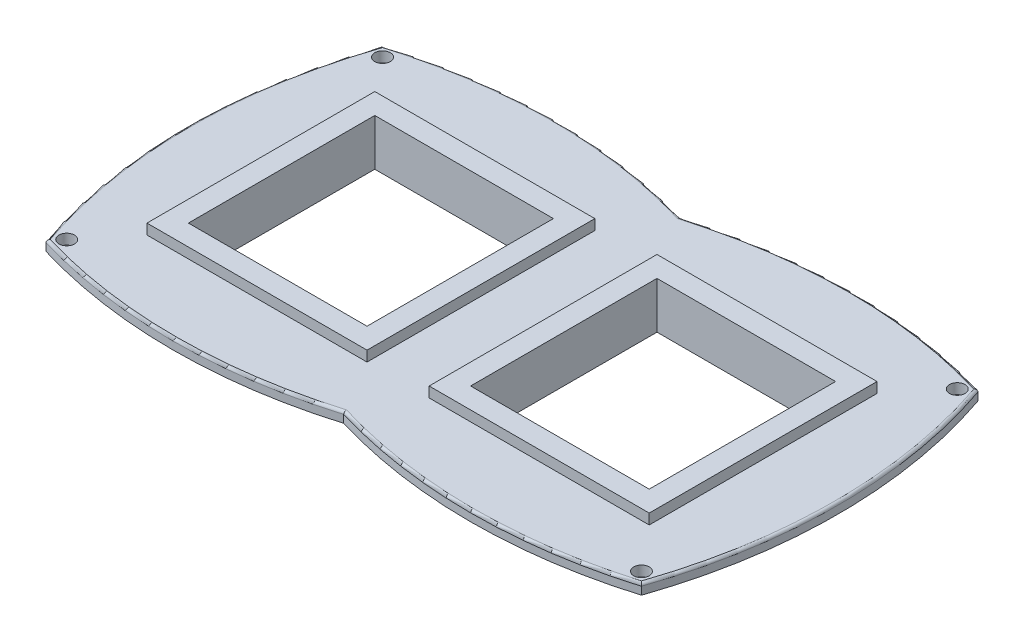
from build123d import *

# Parameters (mm, degrees)
BOSS_EXTRUDE1_DEPTH = 2
HOLE1_D             = 3
HOLE1_DEPTH         = 10
FILLET1_R           = 0.5
SKETCH7_W           = 34.5
SKETCH7_H           = 36
CUT_EXTRUDE1_DEPTH  = 2
SKETCH9_W           = 36.5
SKETCH9_H           = 38
SKETCH9_W_2         = 34.5
SKETCH9_H_2         = 36
BOSS_EXTRUDE2_DEPTH = 5
SKETCH10_W          = 42.5
SKETCH10_H          = 44
SKETCH10_W_2        = 34.5
SKETCH10_H_2        = 36
BOSS_EXTRUDE3_DEPTH = 2


with BuildPart() as part:
    # Sketch2 → Boss-Extrude1 (new body)
    with BuildSketch(Plane(origin=(0, 0, 0), x_dir=(1, 0, 0), z_dir=(0, 1, 0))):
        with BuildLine():
            ThreePointArc((-57.5, 32.5), (-28.75, 36.721936228), (0, 32.5))
            ThreePointArc((0, 32.5), (28.75, 36.721936228), (57.5, 32.5))
            ThreePointArc((57.5, 32.5), (62.928598403, 0), (57.5, -32.5))
            ThreePointArc((57.5, -32.5), (28.75, -36.721936228), (0, -32.5))
            ThreePointArc((0, -32.5), (-28.75, -36.721936228), (-57.5, -32.5))
            ThreePointArc((-57.5, -32.5), (-62.928598403, 0), (-57.5, 32.5))
        make_face()
    extrude(amount=BOSS_EXTRUDE1_DEPTH)

    # Hole1
    with Locations(Plane(origin=(0, 2, 0), x_dir=(1, 0, 0), z_dir=(0, 1, 0))):
        with Locations((-55.5, 30.5), (55.5, 30.5), (55.5, -30.5), (-55.5, -30.5)):
            Hole(HOLE1_D / 2, depth=HOLE1_DEPTH)

    # Fillet1
    fillet1_edges = [part.edges().sort_by_distance(p)[0] for p in [
        (28.75, 2, 36.721936228),
        (62.928598403, 2, 0),
        (28.75, 2, -36.721936228),
        (-28.75, 2, -36.721936228),
        (-62.928598403, 2, 0),
        (-28.75, 2, 36.721936228),
    ]]
    fillet(fillet1_edges, radius=FILLET1_R)

    # Sketch7 → Cut-Extrude1 (cut)
    with BuildSketch(Plane(origin=(0, 2, 0), x_dir=(1, 0, 0), z_dir=(0, 1, 0))):
        with Locations((-27.25, 0)):
            Rectangle(SKETCH7_W, SKETCH7_H)
    cut_extrude1 = extrude(amount=-CUT_EXTRUDE1_DEPTH, mode=Mode.SUBTRACT)

    # Sketch9 → Boss-Extrude2 (add)
    with BuildSketch(Plane.XZ):
        with Locations((-27.25, 0)):
            Rectangle(SKETCH9_W, SKETCH9_H)
        with Locations((-27.25, 0)):
            Rectangle(SKETCH9_W_2, SKETCH9_H_2, mode=Mode.SUBTRACT)
    boss_extrude2 = extrude(amount=BOSS_EXTRUDE2_DEPTH)

    # Sketch10 → Boss-Extrude3 (add)
    with BuildSketch(Plane(origin=(0, 2, 0), x_dir=(1, 0, 0), z_dir=(0, 1, 0))):
        with Locations((-27.25, 0)):
            Rectangle(SKETCH10_W, SKETCH10_H)
        with Locations((-27.25, 0)):
            Rectangle(SKETCH10_W_2, SKETCH10_H_2, mode=Mode.SUBTRACT)
    boss_extrude3 = extrude(amount=BOSS_EXTRUDE3_DEPTH)

    # Mirror1: Cut-Extrude1, Boss-Extrude2, Boss-Extrude3 across plane
    add(cut_extrude1.mirror(Plane(origin=(0, 0, 0), x_dir=(0, 0, 1), z_dir=(1, 0, 0))), mode=Mode.SUBTRACT)
    add(boss_extrude2.mirror(Plane(origin=(0, 0, 0), x_dir=(0, 0, 1), z_dir=(1, 0, 0))))
    add(boss_extrude3.mirror(Plane(origin=(0, 0, 0), x_dir=(0, 0, 1), z_dir=(1, 0, 0))))


solid = part.part
